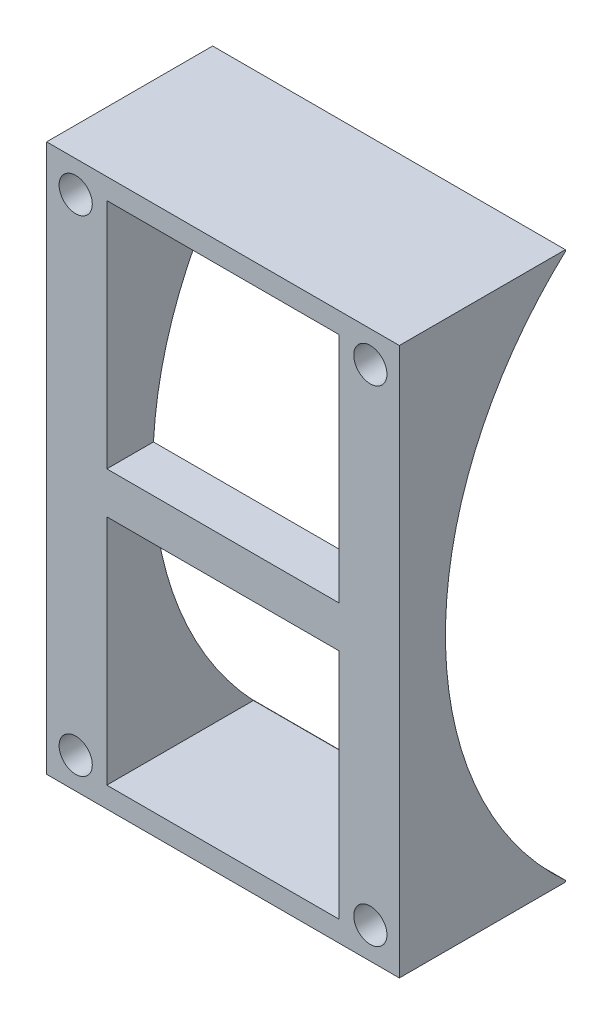
from build123d import *

# Parameters (mm, degrees)
SKETCH1_W               = 42.5
SKETCH1_H               = 66
SKETCH1_W_2             = 28
SKETCH1_H_2             = 28
BOSS_EXTRUDE1_DEPTH     = 20
CUT_EXTRUDE1_DEPTH      = 26
CUT_EXTRUDE1_DEPTH_BACK = 27
SKETCH3_R               = 44.45
SKETCH4_R               = 2
CUT_EXTRUDE2_DEPTH      = 27


with BuildPart() as part:
    # Sketch1 → Boss-Extrude1 (new body)
    with BuildSketch(Plane.XY):
        Rectangle(SKETCH1_W, SKETCH1_H)
        with Locations((0, 16.5)):
            Rectangle(SKETCH1_W_2, SKETCH1_H_2, mode=Mode.SUBTRACT)
        with Locations((0, -16.5)):
            Rectangle(SKETCH1_W_2, SKETCH1_H_2, mode=Mode.SUBTRACT)
    extrude(amount=BOSS_EXTRUDE1_DEPTH)

    # Sketch3 → Cut-Extrude1 (cut, two sides: drawn at the far end of the back side and taken through both)
    with BuildSketch(Plane(origin=(0, 0, 0), x_dir=(0, 0, -1), z_dir=(1, 0, 0)).offset(-CUT_EXTRUDE1_DEPTH_BACK)):
        with Locations((30, 0)):
            Circle(SKETCH3_R)
    extrude(amount=CUT_EXTRUDE1_DEPTH + CUT_EXTRUDE1_DEPTH_BACK, mode=Mode.SUBTRACT)

    # Sketch4 → Cut-Extrude2 (cut)
    with BuildSketch(Plane.XY.offset(20)):
        with Locations((-17.75, 29.25)):
            Circle(SKETCH4_R)
        with Locations((17.75, 29.25)):
            Circle(SKETCH4_R)
        with Locations((-17.75, -29.25)):
            Circle(SKETCH4_R)
        with Locations((17.75, -29.25)):
            Circle(SKETCH4_R)
    extrude(amount=-CUT_EXTRUDE2_DEPTH, mode=Mode.SUBTRACT)


solid = part.part
